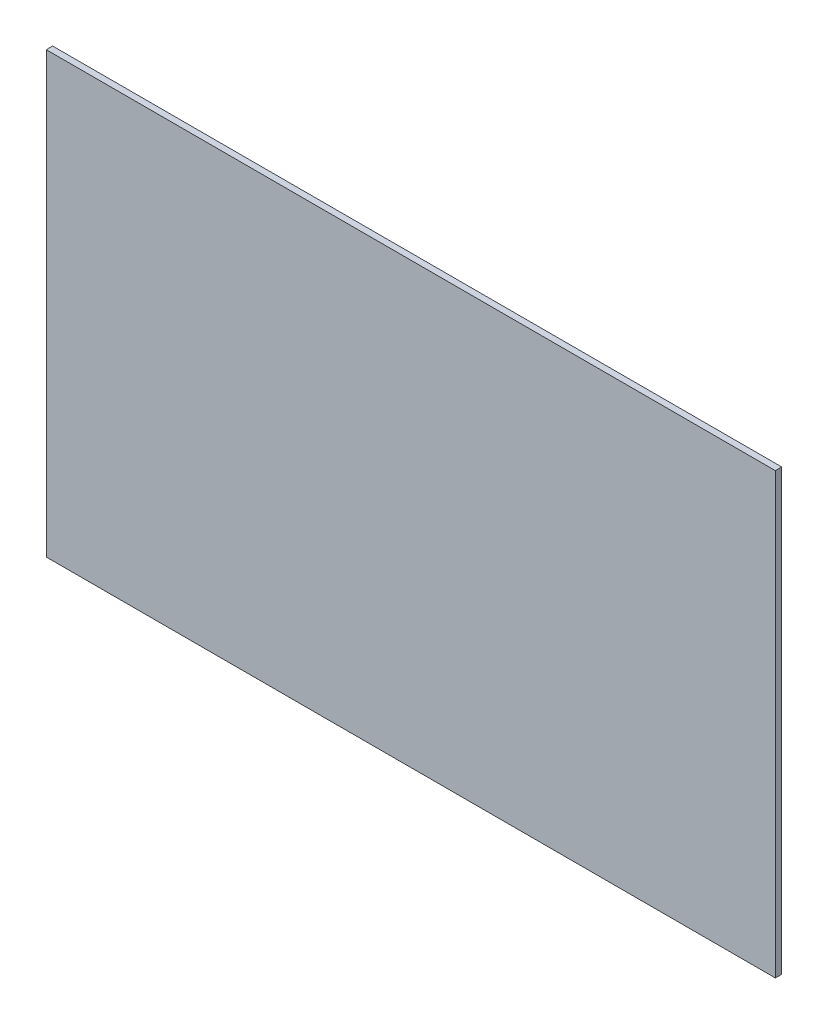
from build123d import *

# Parameters (mm, degrees)
SKETCH_1_W      = 229
SKETCH_1_H      = 138
EXTRUDE_1_DEPTH = 2


with BuildPart() as part:
    # 스케치1 → 보스-돌출1 (new body)
    with BuildSketch(Plane.XY):
        Rectangle(SKETCH_1_W, SKETCH_1_H)
    extrude(amount=EXTRUDE_1_DEPTH)


solid = part.part
